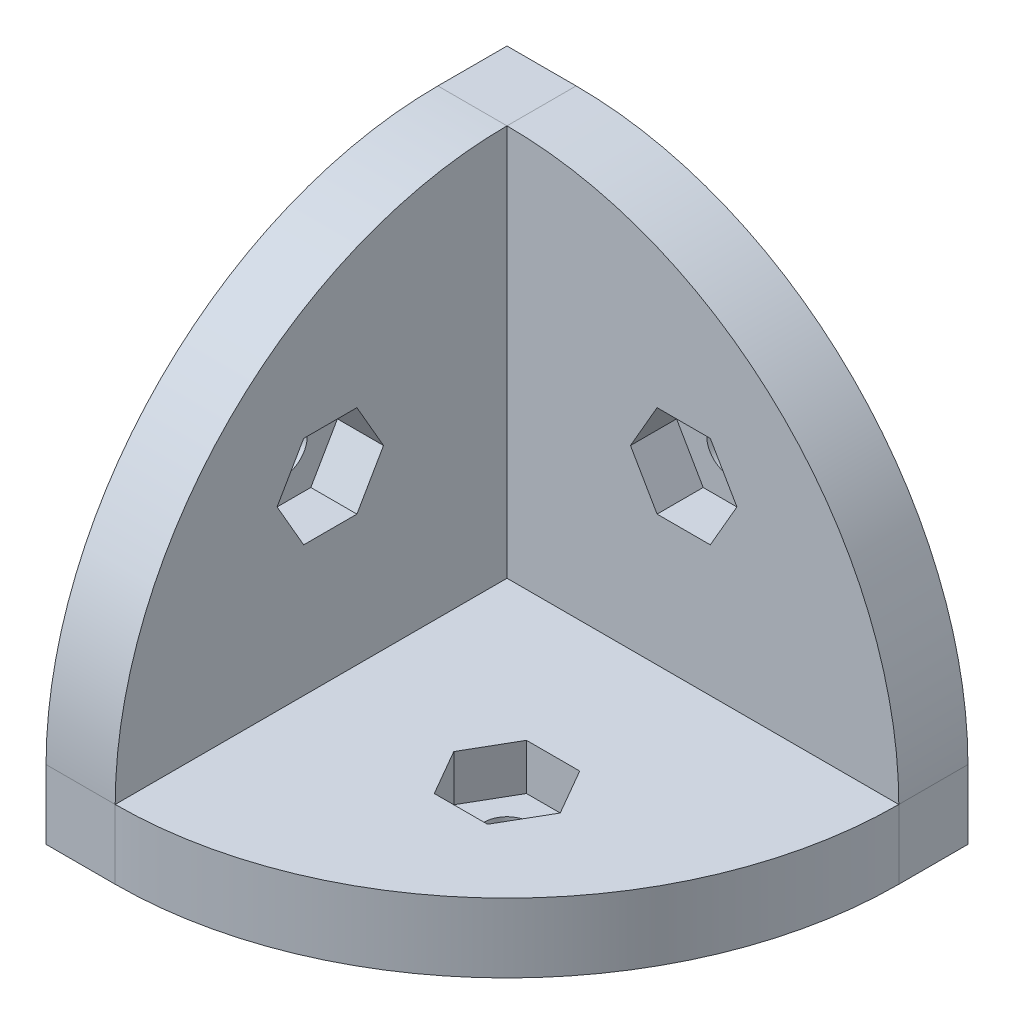
from build123d import *

# Parameters (mm, degrees)
BOSS_EXTRUDE3_DEPTH = 30
BOSS_EXTRUDE4_DEPTH = 4.5
CUT_EXTRUDE3_DEPTH  = 4.5
CUT_EXTRUDE4_DEPTH  = 4.5
SKETCH9_R           = 1.5
CUT_EXTRUDE5_DEPTH  = 4.5
CUT_EXTRUDE6_DEPTH  = 3
SKETCH12_R          = 1.5
CUT_EXTRUDE8_DEPTH  = 50.5
CUT_EXTRUDE9_DEPTH  = 3
SKETCH14_R          = 1.5
CUT_EXTRUDE10_DEPTH = 50.5
CUT_EXTRUDE11_DEPTH = 3


with BuildPart() as part:
    # Sketch1 → Boss-Extrude3 (new body)
    with BuildSketch(Plane.XY):
        Polygon((0, 0), (0, 30), (4.5, 30), (4.5, 4.5), (30, 4.5), (30, 0), align=None)
    extrude(amount=BOSS_EXTRUDE3_DEPTH)

    # Sketch6 → Boss-Extrude4 (add)
    with BuildSketch(Plane(origin=(0, 0, 0), x_dir=(-1, 0, 0), z_dir=(0, 0, -1))):
        with BuildLine():
            Line((0, 0), (0, 30))
            Line((0, 30), (-4.5, 30))
            ThreePointArc((-4.5, 30), (-22.53122292, 22.53122292), (-30, 4.5))
            Line((-30, 4.5), (-30, 0))
            Line((-30, 0), (0, 0))
        make_face()
    extrude(amount=-BOSS_EXTRUDE4_DEPTH)

    # Sketch7 → Cut-Extrude3 (cut)
    with BuildSketch(Plane(origin=(4.5, 0, 0), x_dir=(0, 0, -1), z_dir=(1, 0, 0))):
        with BuildLine():
            Line((-30, 4.5), (-56.330793143, 4.5))
            Line((-56.330793143, 4.5), (-56.330793143, 46.447924187))
            Line((-56.330793143, 46.447924187), (-4.5, 46.447924187))
            Line((-4.5, 46.447924187), (-4.5, 30))
            ThreePointArc((-4.5, 30), (-22.53122292, 22.53122292), (-30, 4.5))
        make_face()
    extrude(amount=-CUT_EXTRUDE3_DEPTH, mode=Mode.SUBTRACT)

    # Sketch8 → Cut-Extrude4 (cut)
    with BuildSketch(Plane(origin=(0, 4.5, 0), x_dir=(1, 0, 0), z_dir=(0, 1, 0))):
        with BuildLine():
            Line((4.5, -30), (4.5, -32.471065144))
            Line((4.5, -32.471065144), (33.329643203, -32.471065144))
            Line((33.329643203, -32.471065144), (33.329643203, -4.5))
            Line((33.329643203, -4.5), (30, -4.5))
            ThreePointArc((30, -4.5), (22.53122292, -22.53122292), (4.5, -30))
        make_face()
    extrude(amount=-CUT_EXTRUDE4_DEPTH, mode=Mode.SUBTRACT)

    # Sketch9 → Cut-Extrude5 (cut)
    with BuildSketch(Plane.XY.offset(4.5)):
        with Locations((16, 16)):
            Circle(SKETCH9_R)
    extrude(amount=-CUT_EXTRUDE5_DEPTH, mode=Mode.SUBTRACT)

    # Sketch10 → Cut-Extrude6 (cut)
    with BuildSketch(Plane.XY.offset(4.5)):
        Polygon((19.464101615, 16), (17.732050808, 19), (14.267949192, 19), (12.535898385, 16), (14.267949192, 13), (17.732050808, 13), align=None)
    extrude(amount=-CUT_EXTRUDE6_DEPTH, mode=Mode.SUBTRACT)

    # Sketch12 → Cut-Extrude8 (cut, through all)
    with BuildSketch(Plane(origin=(0, 4.5, 0), x_dir=(1, 0, 0), z_dir=(0, 1, 0))):
        with Locations(Location((16, -16, 0), (0, 0, 180))):
            Circle(SKETCH12_R)
    extrude(amount=-CUT_EXTRUDE8_DEPTH, mode=Mode.SUBTRACT)

    # Sketch13 → Cut-Extrude9 (cut)
    with BuildSketch(Plane(origin=(0, 4.5, 0), x_dir=(1, 0, 0), z_dir=(0, 1, 0))):
        Polygon((19.464101615, -16), (17.732050808, -13), (14.267949192, -13), (12.535898385, -16), (14.267949192, -19), (17.732050808, -19), align=None)
    extrude(amount=-CUT_EXTRUDE9_DEPTH, mode=Mode.SUBTRACT)

    # Sketch14 → Cut-Extrude10 (cut, through all)
    with BuildSketch(Plane(origin=(4.5, 0, 0), x_dir=(0, 0, -1), z_dir=(1, 0, 0))):
        with Locations(Location((-16, 16, 0), (0, 0, 90))):
            Circle(SKETCH14_R)
    extrude(amount=-CUT_EXTRUDE10_DEPTH, mode=Mode.SUBTRACT)

    # Sketch15 → Cut-Extrude11 (cut)
    with BuildSketch(Plane(origin=(4.5, 0, 0), x_dir=(0, 0, -1), z_dir=(1, 0, 0))):
        Polygon((-19.464101615, 16), (-17.732050808, 13), (-14.267949192, 13), (-12.535898385, 16), (-14.267949192, 19), (-17.732050808, 19), align=None)
    extrude(amount=-CUT_EXTRUDE11_DEPTH, mode=Mode.SUBTRACT)


solid = part.part
